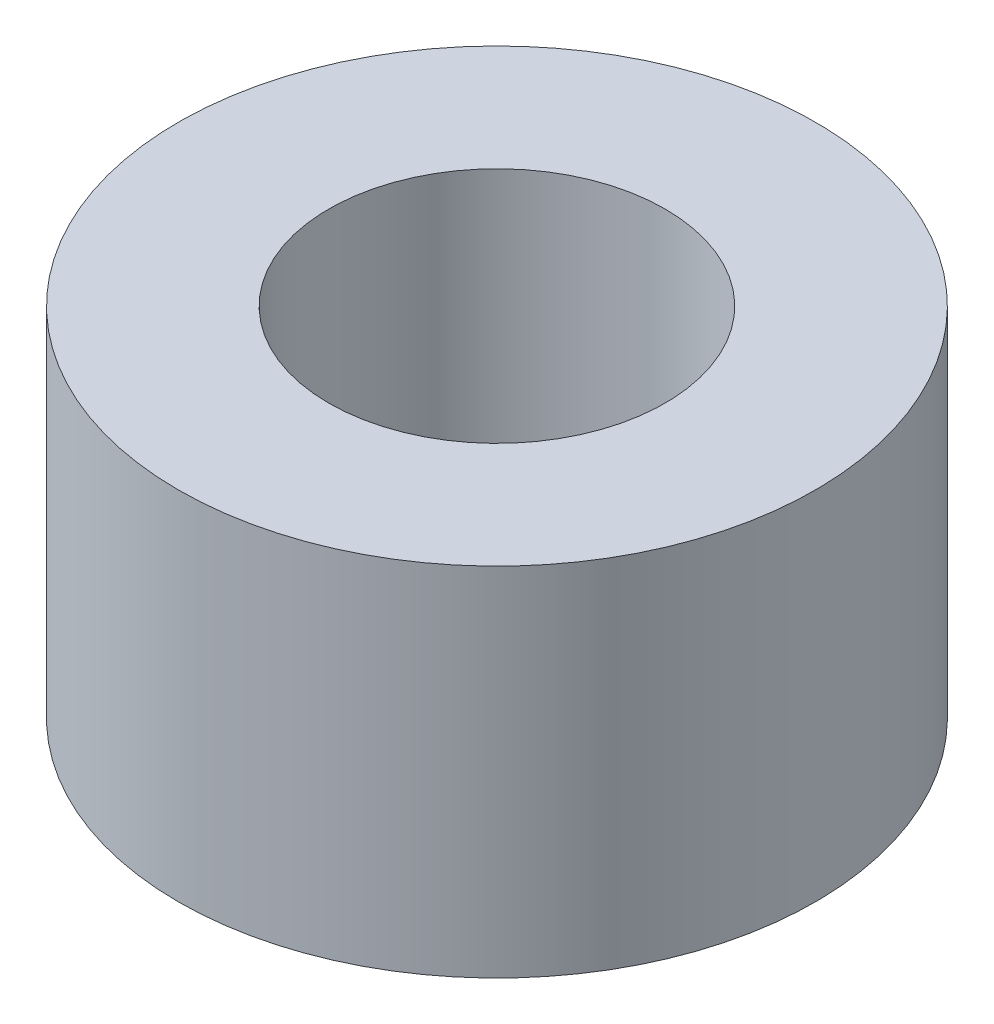
from build123d import *

# Parameters (mm, degrees)
SKETCH1_R           = 6.25
SKETCH1_R_2         = 3.3
BOSS_EXTRUDE1_DEPTH = 7


with BuildPart() as part:
    # Sketch1 → Boss-Extrude1 (new body)
    with BuildSketch(Plane(origin=(0, 0, 0), x_dir=(1, 0, 0), z_dir=(0, 1, 0))):
        with Locations(Location((0, 0, 0), (0, 0, 270))):
            Circle(SKETCH1_R)
        with Locations(Location((0, 0, 0), (0, 0, 270))):
            Circle(SKETCH1_R_2, mode=Mode.SUBTRACT)
    extrude(amount=BOSS_EXTRUDE1_DEPTH)


solid = part.part
